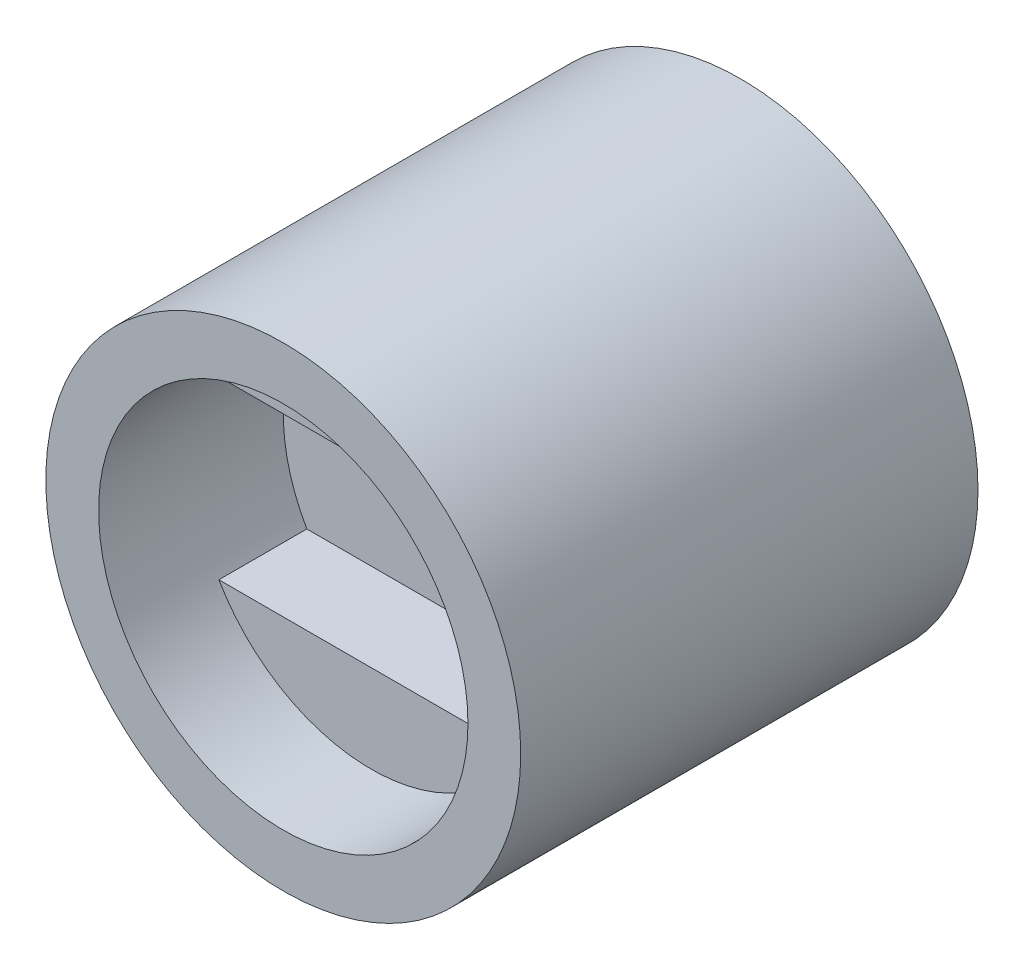
from build123d import *

# Parameters (mm, degrees)
ESBO_O1_R                    = 10
RESSALTO_EXTRUS_O1_DEPTH     = 16
CORTE_EXTRUS_O3_REACH        = 23.354
ESBO_O5_R                    = 2.5
CORTE_EXTRUS_O1_START        = -5
CORTE_EXTRUS_O1_DEPTH        = 5
CORTE_EXTRUS_O2_DEPTH        = 5
SALIENTE_EXTRUIR1_DEPTH      = 5
SALIENTE_EXTRUIR1_DEPTH_BACK = 21
CROQUIS1_R                   = 13.5
CROQUIS1_R_2                 = 10.5


with BuildPart() as part:
    # Esboço1 → Ressalto-extrusão1 (new body)
    with BuildSketch(Plane.XY):
        Circle(ESBO_O1_R)
    extrude(amount=RESSALTO_EXTRUS_O1_DEPTH)

    # Esboço5 → Corte-extrusão3 (cut, up to next)
    with BuildSketch(Plane.XY.offset(16), mode=Mode.PRIVATE) as corte_extrus_o3_sk1:
        Circle(ESBO_O5_R)
    corte_extrus_o3_tool1 = extrude(corte_extrus_o3_sk1.sketch, amount=-CORTE_EXTRUS_O3_REACH, mode=Mode.PRIVATE) & part.part
    add(corte_extrus_o3_tool1.solids().sort_by_distance((0, 0, 16))[0], mode=Mode.SUBTRACT)

    # Esboço2 → Corte-extrusão1 (cut)
    with BuildSketch(Plane.XY.offset(16).offset(CORTE_EXTRUS_O1_START)):
        with BuildLine():
            Line((-8.660254038, 5), (8.660254038, 5))
            ThreePointArc((8.660254038, 5), (10, 0), (8.660254038, -5))
            Line((8.660254038, -5), (-8.660254038, -5))
            ThreePointArc((-8.660254038, -5), (-10, 0), (-8.660254038, 5))
        make_face()
    extrude(amount=CORTE_EXTRUS_O1_DEPTH, mode=Mode.SUBTRACT)

    # Esboço4 → Corte-extrusão2 (cut)
    with BuildSketch(Plane(origin=(0, 0, 0), x_dir=(-1, 0, 0), z_dir=(0, 0, -1))):
        with BuildLine():
            Line((-5, 8.660254038), (-5, -8.660254038))
            ThreePointArc((-5, -8.660254038), (0, -10), (5, -8.660254038))
            Line((5, -8.660254038), (5, 8.660254038))
            ThreePointArc((5, 8.660254038), (0, 10), (-5, 8.660254038))
        make_face()
    extrude(amount=-CORTE_EXTRUS_O2_DEPTH, mode=Mode.SUBTRACT)


with BuildPart() as body_2:
    # Croquis1 → Saliente-Extruir1 (new, two sides: drawn at the far end of the back side and taken through both)
    with BuildSketch(Plane.XY.offset(16).offset(-SALIENTE_EXTRUIR1_DEPTH_BACK)):
        Circle(CROQUIS1_R)
        Circle(CROQUIS1_R_2, mode=Mode.SUBTRACT)
    extrude(amount=SALIENTE_EXTRUIR1_DEPTH + SALIENTE_EXTRUIR1_DEPTH_BACK)


solid = Compound([part.part, body_2.part])
